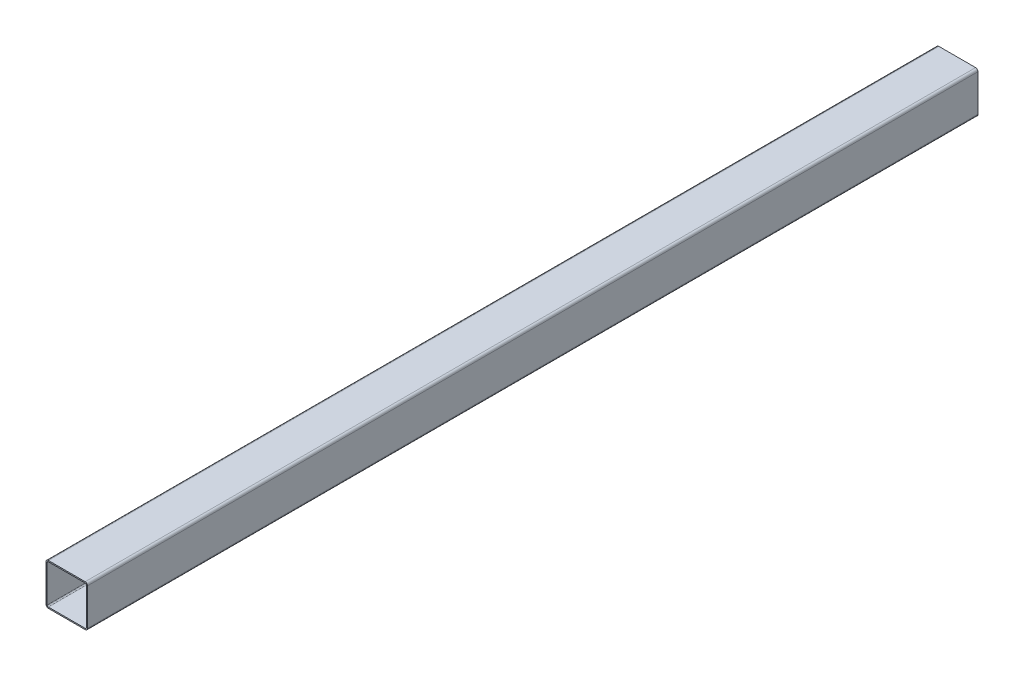
from build123d import *

# Parameters (mm, degrees)
BOSS_EXTRUDE1_DEPTH = 1500


with BuildPart() as part:
    # Sketch1 → Boss-Extrude1 (new body)
    with BuildSketch(Plane.XY):
        with BuildLine():
            Line((29.05785124, 22.702479339), (-32.94214876, 22.702479339))
            ThreePointArc((-32.94214876, 22.702479339), (-35.770575885, 21.530906464), (-36.94214876, 18.702479339))
            Line((-36.94214876, 18.702479339), (-36.94214876, -43.297520661))
            ThreePointArc((-36.94214876, -43.297520661), (-35.770575885, -46.125947786), (-32.94214876, -47.297520661))
            Line((-32.94214876, -47.297520661), (29.05785124, -47.297520661))
            ThreePointArc((29.05785124, -47.297520661), (31.886278364, -46.125947786), (33.05785124, -43.297520661))
            Line((33.05785124, -43.297520661), (33.05785124, 18.702479339))
            ThreePointArc((33.05785124, 18.702479339), (31.886278364, 21.530906464), (29.05785124, 22.702479339))
        make_face()
        with BuildLine():
            Line((29.05785124, 20.702479339), (-32.94214876, 20.702479339))
            ThreePointArc((-32.94214876, 20.702479339), (-34.356362323, 20.116692901), (-34.94214876, 18.702479339))
            Line((-34.94214876, 18.702479339), (-34.94214876, -43.297520661))
            ThreePointArc((-34.94214876, -43.297520661), (-34.356362323, -44.711734224), (-32.94214876, -45.297520661))
            Line((-32.94214876, -45.297520661), (29.05785124, -45.297520661))
            ThreePointArc((29.05785124, -45.297520661), (30.472064802, -44.711734224), (31.05785124, -43.297520661))
            Line((31.05785124, -43.297520661), (31.05785124, 18.702479339))
            ThreePointArc((31.05785124, 18.702479339), (30.472064802, 20.116692901), (29.05785124, 20.702479339))
        make_face(mode=Mode.SUBTRACT)
    extrude(amount=BOSS_EXTRUDE1_DEPTH)


solid = part.part
